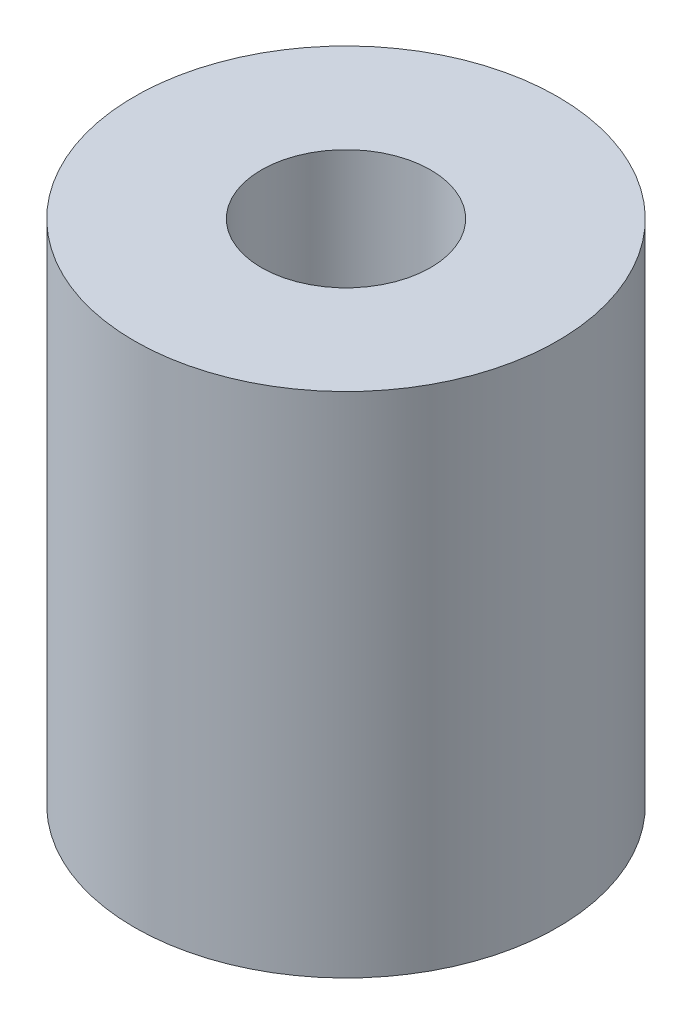
from build123d import *

# Parameters (mm, degrees)
SKETCH1_R           = 6.25
SKETCH1_R_2         = 2.5
BOSS_EXTRUDE1_DEPTH = 15


with BuildPart() as part:
    # Sketch1 → Boss-Extrude1 (new body)
    with BuildSketch(Plane(origin=(0, 0, 0), x_dir=(1, 0, 0), z_dir=(0, 1, 0))):
        with Locations(Location((0, 0, 0), (0, 0, 270))):
            Circle(SKETCH1_R)
        with Locations(Location((0, 0, 0), (0, 0, 270))):
            Circle(SKETCH1_R_2, mode=Mode.SUBTRACT)
    extrude(amount=BOSS_EXTRUDE1_DEPTH)


solid = part.part
